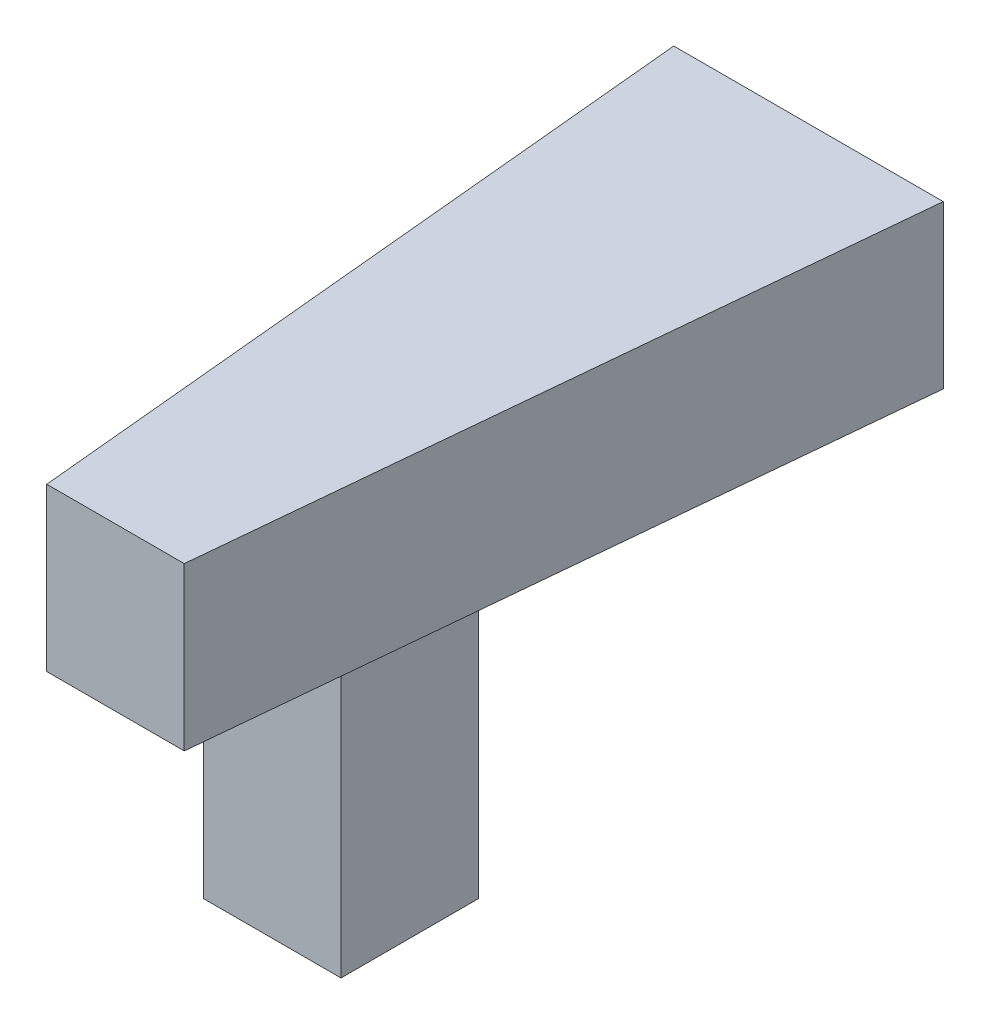
from build123d import *

# Parameters (mm, degrees)
BOSS_EXTRUDE1_DEPTH = 59
SKETCH3_W           = 50
SKETCH3_H           = 50
BOSS_EXTRUDE2_DEPTH = 100


with BuildPart() as part:
    # Sketch1 → Boss-Extrude1 (new body)
    with BuildSketch(Plane(origin=(0, 0, 0), x_dir=(1, 0, 0), z_dir=(0, 1, 0))):
        Polygon((-25, -10), (25, -10), (49, 242), (-49, 242), align=None)
    extrude(amount=BOSS_EXTRUDE1_DEPTH)

    # Sketch3 → Boss-Extrude2 (add)
    with BuildSketch(Plane(origin=(0, 0, 0), x_dir=(1, 0, 0), z_dir=(0, 1, 0))):
        with Locations((0, 72)):
            Rectangle(SKETCH3_W, SKETCH3_H)
    extrude(amount=-BOSS_EXTRUDE2_DEPTH)


solid = part.part
